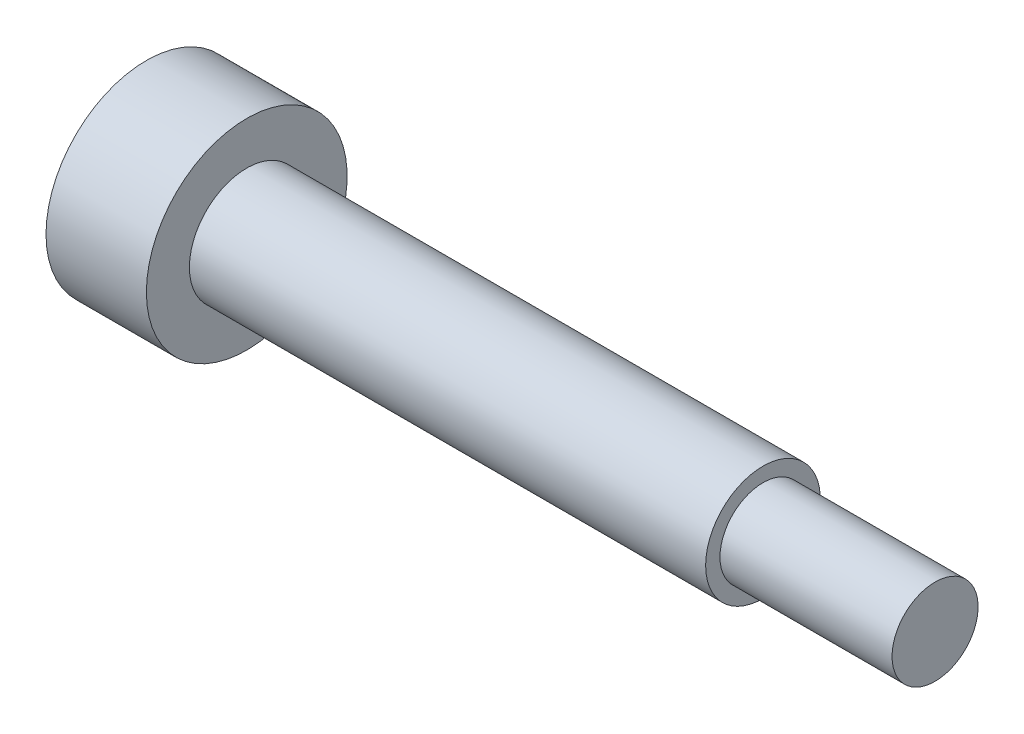
from build123d import *

# Parameters (mm, degrees)
CUT_EXTRUDE_1_DEPTH = 3


with BuildPart() as part:
    # 草图1 → 旋转1 (revolve)
    with BuildSketch(Plane.XY, mode=Mode.PRIVATE) as revolve_1_sk:
        Polygon((0, 0), (0, 3.5), (3.5, 3.5), (3.5, 2), (21.5, 2), (21.5, 1.5), (27.5, 1.5), (27.5, 0), align=None)
    revolve(revolve_1_sk.sketch.rotate(Axis((0, 0, 0), (1, 0, 0)), 90), axis=Axis((0, 0, 0), (1, 0, 0)))

    # 草图2 → 切除-拉伸1 (cut)
    with BuildSketch(Plane.ZY):
        Polygon((0, 2.886751346), (-2.5, 1.443375673), (-2.5, -1.443375673), (0, -2.886751346), (2.5, -1.443375673), (2.5, 1.443375673), align=None)
    extrude(amount=-CUT_EXTRUDE_1_DEPTH, mode=Mode.SUBTRACT)


solid = part.part
